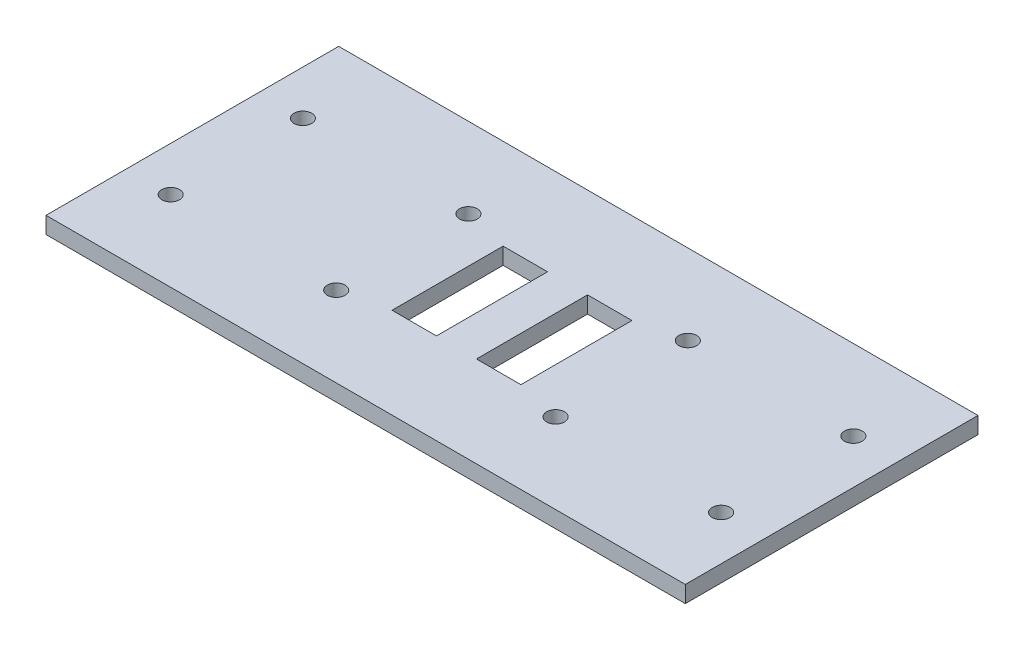
from build123d import *

# Parameters (mm, degrees)
ESBO_O1_W                = 115.09677689
ESBO_O1_H                = 52.692711406
RESSALTO_EXTRUS_O1_DEPTH = 3
ESBO_O2_R                = 1.6
CORTE_EXTRUS_O1_DEPTH    = 64.36361315
ESBO_O3_W                = 8
ESBO_O3_H                = 20
CORTE_EXTRUS_O2_DEPTH    = 64.36361315


with BuildPart() as part:
    # Esboço1 → Ressalto-extrusão1 (new body)
    with BuildSketch(Plane(origin=(0, 0, 0), x_dir=(1, 0, 0), z_dir=(0, 1, 0))):
        Rectangle(ESBO_O1_W, ESBO_O1_H)
    extrude(amount=RESSALTO_EXTRUS_O1_DEPTH)

    # Esboço2 → Corte-extrusão1 (cut, through all)
    with BuildSketch(Plane(origin=(0, 3, 0), x_dir=(1, 0, 0), z_dir=(0, 1, 0))):
        with Locations(Location((-49.548388445, 11.9, 0), (0, 0, 270))):
            Circle(ESBO_O2_R)
        with Locations(Location((-19.748388445, 11.9, 0), (0, 0, 270))):
            Circle(ESBO_O2_R)
        with Locations(Location((-49.548388445, -11.9, 0), (0, 0, 270))):
            Circle(ESBO_O2_R)
        with Locations(Location((-19.748388445, -11.9, 0), (0, 0, 270))):
            Circle(ESBO_O2_R)
        with Locations(Location((49.548388445, -11.9, 0), (0, 0, 90))):
            Circle(ESBO_O2_R)
        with Locations(Location((19.748388445, -11.9, 0), (0, 0, 90))):
            Circle(ESBO_O2_R)
        with Locations(Location((19.748388445, 11.9, 0), (0, 0, 90))):
            Circle(ESBO_O2_R)
        with Locations(Location((49.548388445, 11.9, 0), (0, 0, 90))):
            Circle(ESBO_O2_R)
    extrude(amount=-CORTE_EXTRUS_O1_DEPTH, mode=Mode.SUBTRACT)

    # Esboço3 → Corte-extrusão2 (cut, through all)
    with BuildSketch(Plane(origin=(0, 3, 0), x_dir=(1, 0, 0), z_dir=(0, 1, 0))):
        with Locations((-7.598388445, 0)):
            Rectangle(ESBO_O3_W, ESBO_O3_H)
        with Locations((7.598388445, 0)):
            Rectangle(ESBO_O3_W, ESBO_O3_H)
    extrude(amount=-CORTE_EXTRUS_O2_DEPTH, mode=Mode.SUBTRACT)


solid = part.part
